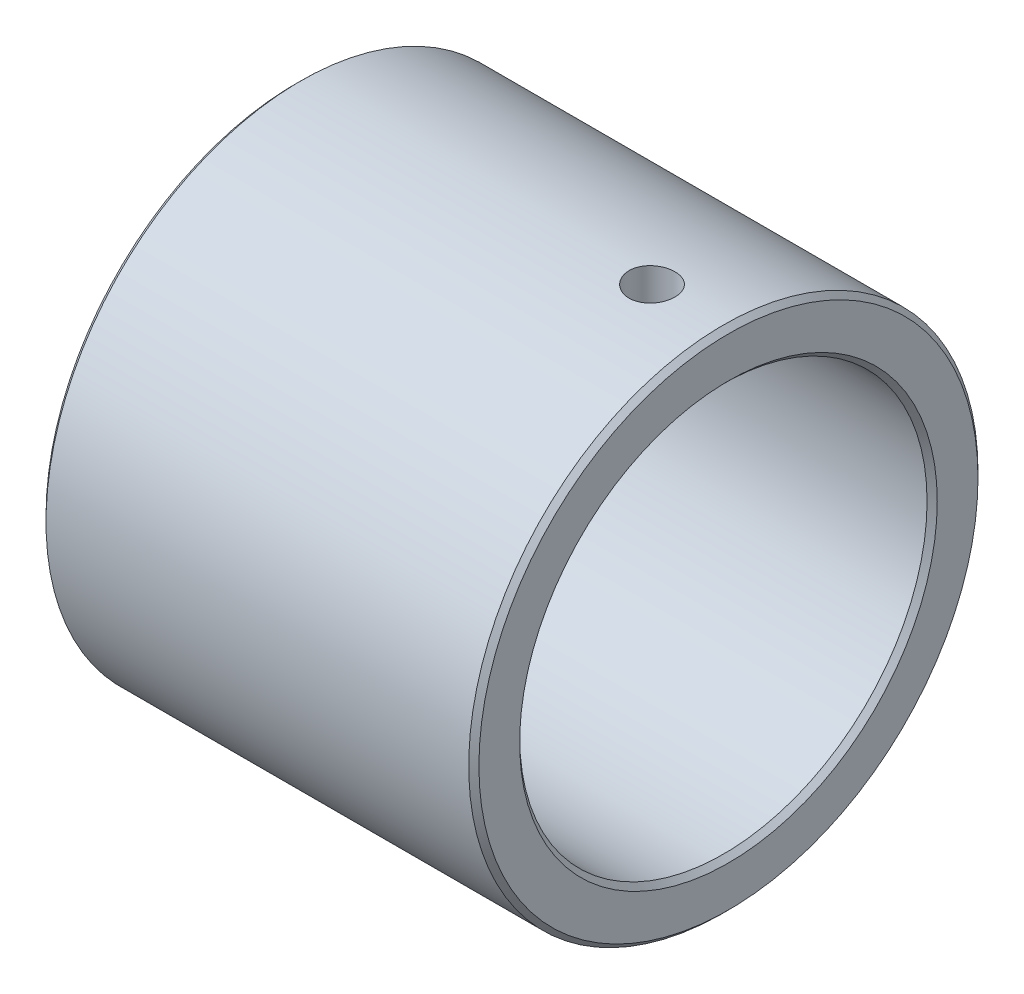
from build123d import *

# Parameters (mm, degrees)
SKETCH_1_R      = 50
SKETCH_1_R_2    = 40
EXTRUDE_1_DEPTH = 85
CHAMFER_1_SIZE  = 1
M10X1_0_1_D     = 9
M10X1_0_1_DEPTH = 25
M10X1_0_1_TIP   = 2.703872786


with BuildPart() as part:
    # 草图1 → 凸台-拉伸1 (new body)
    with BuildSketch(Plane(origin=(0, 0, 0), x_dir=(0, 0, -1), z_dir=(1, 0, 0))):
        Circle(SKETCH_1_R)
        Circle(SKETCH_1_R_2, mode=Mode.SUBTRACT)
    extrude(amount=EXTRUDE_1_DEPTH)

    # 倒角1
    chamfer_1_edges = [part.edges().sort_by_distance(p)[0] for p in [
        (0, 0, 50),
        (85, 0, 50),
        (0, 0, 40),
        (85, 0, 40),
    ]]
    chamfer(chamfer_1_edges, length=CHAMFER_1_SIZE)

    # M10x1.0 螺纹孔1
    with Locations(Plane(origin=(0, 50, 0), x_dir=(1, 0, 0), z_dir=(0, 1, 0))):
        with Locations((70, 0)):
            Hole(M10X1_0_1_D / 2, depth=M10X1_0_1_DEPTH)
            with Locations((0, 0, -(M10X1_0_1_DEPTH + M10X1_0_1_TIP / 2))):  # 118° drill point
                Cone(0, M10X1_0_1_D / 2, M10X1_0_1_TIP, mode=Mode.SUBTRACT)


solid = part.part
